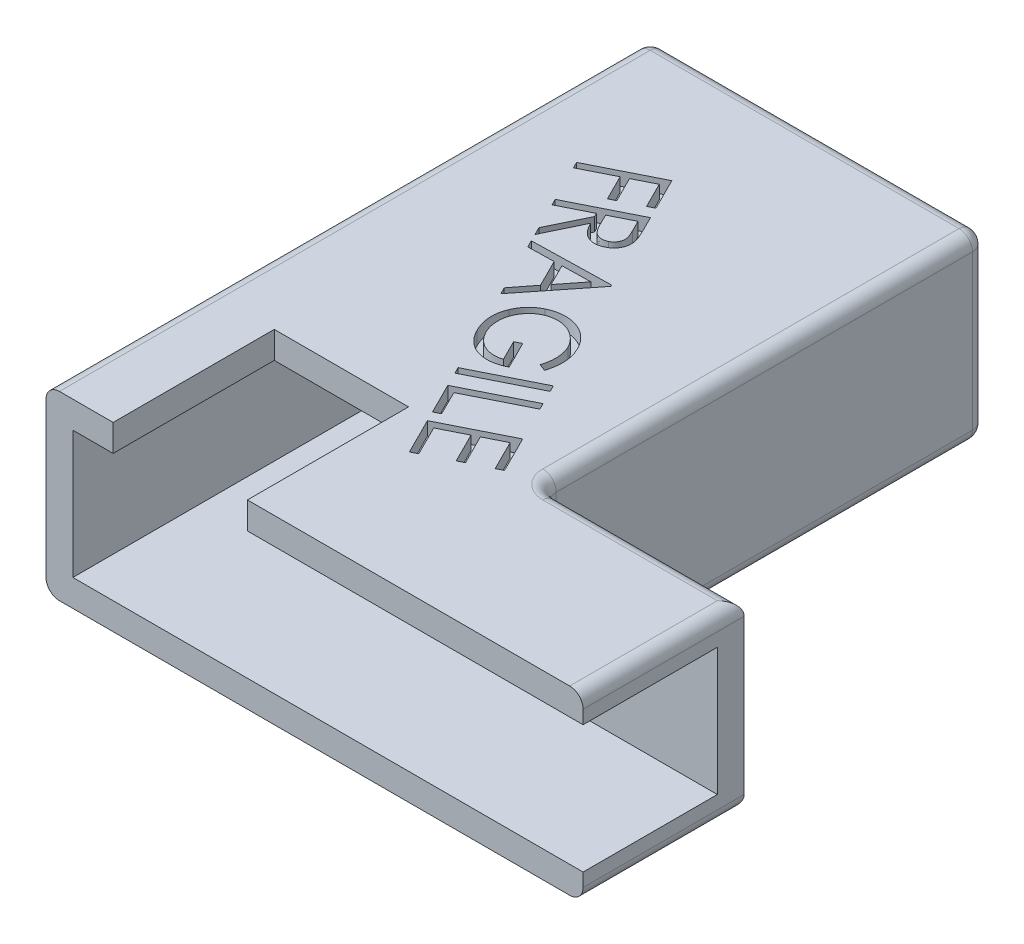
from build123d import *

# Parameters (mm, degrees)
BOSS_EXTRUDE1_DEPTH = 6.75
CUT_EXTRUDE3_DEPTH  = 4.75
CUT_EXTRUDE4_DEPTH  = 1
FILLET2_R           = 1
SKETCH7_W           = 10
SKETCH7_H           = 12
CUT_EXTRUDE6_DEPTH  = 2


with BuildPart() as part:
    # Sketch1 → Boss-Extrude1 (new body)
    with BuildSketch(Plane(origin=(0, 0, 0), x_dir=(1, 0, 0), z_dir=(0, 1, 0))):
        Polygon((0, 0), (0, 45), (25, 45), (25, 12), (40, 12), (40, 0), align=None)
    extrude(amount=BOSS_EXTRUDE1_DEPTH)

    # Sketch4 → Cut-Extrude3 (cut)
    with BuildSketch(Plane(origin=(0, 6.75, 0), x_dir=(1, 0, 0), z_dir=(0, 1, 0))):
        Polygon((2, 0), (2, 43), (23, 43), (23, 10), (40, 10), (40, 0), align=None)
    extrude(amount=-CUT_EXTRUDE3_DEPTH, mode=Mode.SUBTRACT)

    # Mirror2: part across plane


with BuildPart() as part_1:
    add(part.part)
    add(part.part.mirror(Plane(origin=(0, 6.75, 0), x_dir=(0, 0, 1), z_dir=(0, -1, 0))))

    # Sketch5 → Cut-Extrude4 (cut)
    # profile 1 of 7: a face of its own
    with BuildSketch(Plane(origin=(0, 13.5, 0), x_dir=(1, 0, 0), z_dir=(0, 1, 0))):
        Polygon((10.212206657, 36.397034335), (11.398379534, 34.028928699), (10.931966607, 33.795722235), (9.980060223, 35.695294885), (8.502379267, 34.955394378), (9.45428565, 33.055821728), (8.988932752, 32.822615264), (8.037026369, 34.722187914), (5.719802143, 33.561455742), (5.48553565, 34.029988729), align=None)
    # profile 2 of 7: a face of its own
    with BuildSketch(Plane(origin=(0, 13.5, 0), x_dir=(1, 0, 0), z_dir=(0, 1, 0))):
        with BuildLine():
            Line((11.802597194, 33.216253261), (12.274310268, 32.274947172))
            add(Edge.make_bspline(
                [(12.274310268, 32.274947172), (12.305489154, 32.211740664), (12.365122969, 32.090849714), (12.449438342, 31.916556946), (12.523301711, 31.757184775), (12.587769249, 31.612641939), (12.640281225, 31.482558136), (12.684312122, 31.367557019), (12.718958828, 31.267757989), (12.735398463, 31.205121887), (12.742843254, 31.176756734)],
                knots=[0, 0, 0, 0, 1.41450932, 2.705439416, 3.885743353, 4.939894687, 5.88148064, 6.700709836, 7.411608266, 8, 8, 8, 8], degree=3))
            add(Edge.make_bspline(
                [(12.742843254, 31.176756734), (12.751732081, 31.138025173), (12.769303581, 31.061460327), (12.78210829, 30.945611182), (12.78764944, 30.831604923), (12.78504351, 30.718772379), (12.770996925, 30.607391812), (12.747168437, 30.497692725), (12.715800519, 30.389293389), (12.673995923, 30.2835588), (12.625068863, 30.180685136), (12.56521302, 30.084060558), (12.496811122, 29.993485405), (12.420526239, 29.908365935), (12.33491297, 29.829803055), (12.241427583, 29.756168121), (12.138433145, 29.689258606), (12.06475798, 29.650783305), (12.027323423, 29.631233897)],
                knots=[0, 0, 0, 0, 1.030585874, 2.037270015, 3.019599379, 3.992076591, 4.962346036, 5.928228341, 6.903253401, 7.887592627, 8.876066943, 9.855953285, 10.831711236, 11.818738111, 12.818127647, 13.843641548, 14.904348217, 16, 16, 16, 16], degree=3))
            add(Edge.make_bspline(
                [(12.027323423, 29.631233897), (11.96371232, 29.601885041), (11.839690502, 29.54466392), (11.644960762, 29.490320812), (11.450815286, 29.464290674), (11.257828576, 29.467383363), (11.069005111, 29.499185461), (10.886842053, 29.560193267), (10.713802812, 29.65092947), (10.57739765, 29.74810112), (10.473174315, 29.841569185), (10.394056464, 29.922898575), (10.316237194, 30.014955417), (10.239058577, 30.117302488), (10.160856144, 30.228702985), (10.085643601, 30.352027334), (10.008533662, 30.484341339), (9.960547708, 30.577607541), (9.935885455, 30.625541456)],
                knots=[0, 0, 0, 0, 1.275491154, 2.486810117, 3.669320756, 4.835400704, 5.991815185, 7.146793527, 8.32226535, 9.541335358, 10.189151225, 10.872441073, 11.608160371, 12.3850279, 13.208790561, 14.088244423, 15.017458352, 16, 16, 16, 16], degree=3))
            Line((9.935885455, 30.625541456), (8.589648142, 27.826003862))
            Line((8.589648142, 27.826003862), (8.297080033, 28.410080051))
            Line((8.297080033, 28.410080051), (9.645437405, 31.207497586))
            Line((9.645437405, 31.207497586), (9.509753644, 31.477805078))
            Line((9.509753644, 31.477805078), (7.312312739, 30.377494581))
            Line((7.312312739, 30.377494581), (7.075926187, 30.849207655))
            Line((7.075926187, 30.849207655), (11.802597194, 33.216253261))
        make_face()
        with BuildLine():
            Line((11.575750907, 32.512393753), (9.969806395, 31.708891483))
            Line((9.969806395, 31.708891483), (10.370497501, 30.89266886))
            add(Edge.make_bspline(
                [(10.370497501, 30.89266886), (10.389646738, 30.854710369), (10.426822117, 30.781019635), (10.485279443, 30.67684209), (10.541166707, 30.581009266), (10.596360095, 30.494477686), (10.651336963, 30.417739557), (10.704344627, 30.34882681), (10.757057523, 30.289954798), (10.824155329, 30.223488425), (10.912893071, 30.155981521), (11.026225342, 30.092730161), (11.147785245, 30.049646714), (11.274289309, 30.025723143), (11.403748539, 30.019760355), (11.532418148, 30.035874822), (11.659778409, 30.067628306), (11.739833914, 30.104455476), (11.780336577, 30.12308753)],
                knots=[0, 0, 0, 0, 1.114428451, 2.163496172, 3.130994844, 4.022616522, 4.852843401, 5.605155819, 6.30056977, 6.922856548, 8.078968302, 9.210815528, 10.312466522, 11.444275841, 12.575326779, 13.694442081, 14.833543843, 16, 16, 16, 16], degree=3))
            add(Edge.make_bspline(
                [(11.780336577, 30.12308753), (11.818527766, 30.143842197), (11.893875502, 30.184789264), (11.993382793, 30.265902544), (12.078867704, 30.360318489), (12.150460422, 30.465955407), (12.207388066, 30.579657841), (12.24274531, 30.69925602), (12.262273961, 30.821285895), (12.259437556, 30.925579085), (12.248381629, 31.013680124), (12.231905973, 31.08719059), (12.209587597, 31.168306501), (12.179580662, 31.256320925), (12.142132957, 31.351521563), (12.09853445, 31.454321249), (12.0488834, 31.564856846), (12.011675543, 31.640109572), (11.992342453, 31.67921066)],
                knots=[0, 0, 0, 0, 1.162087497, 2.292692764, 3.418137779, 4.562520382, 5.700979498, 6.808619015, 7.889994426, 8.997350933, 9.588933592, 10.266395831, 11.012550037, 11.841485571, 12.75530961, 13.75187071, 14.831878838, 16, 16, 16, 16], degree=3))
            Line((11.992342453, 31.67921066), (11.575750907, 32.512393753))
        make_face(mode=Mode.SUBTRACT)
    # profile 3 of 7: a face of its own
    with BuildSketch(Plane(origin=(0, 13.5, 0), x_dir=(1, 0, 0), z_dir=(0, 1, 0))):
        Polygon((14.759051178, 27.306525382), (11.136930785, 22.734618665), (10.882523734, 23.242372738), (12.065516522, 24.763514899), (11.045768258, 26.800891368), (9.120754904, 26.760610251), (8.856807588, 27.287444853), (14.700749562, 27.422068585), align=None)
        Polygon((13.727642591, 26.861313042), (11.608643859, 26.817851838), (12.417446277, 25.201307033), align=None, mode=Mode.SUBTRACT)
    # profile 4 of 7: a face of its own
    with BuildSketch(Plane(origin=(0, 13.5, 0), x_dir=(1, 0, 0), z_dir=(0, 1, 0))):
        with BuildLine():
            Line((17.708830561, 19.425771704), (17.178815871, 19.618697051))
            add(Edge.make_bspline(
                [(17.178815871, 19.618697051), (17.207920262, 19.716095321), (17.265319744, 19.908183523), (17.317561161, 20.201005748), (17.342407251, 20.491274396), (17.33937834, 20.7774171), (17.309371681, 21.054354488), (17.258333981, 21.318507181), (17.1815624, 21.566835111), (17.110851687, 21.721748779), (17.075993021, 21.798117457)],
                knots=[0, 0, 0, 0, 1.090643464, 2.150959598, 3.186474562, 4.214576681, 5.217906055, 6.17316086, 7.099412641, 8, 8, 8, 8], degree=3))
            add(Edge.make_bspline(
                [(17.075993021, 21.798117457), (17.052252497, 21.843709824), (17.00482034, 21.934800666), (16.922516941, 22.064349154), (16.834810143, 22.189423517), (16.737593398, 22.307300785), (16.632874987, 22.419606308), (16.519902463, 22.525731442), (16.4002096, 22.626591739), (16.273597573, 22.720605688), (16.141639872, 22.805851937), (16.006629651, 22.882705861), (15.86898284, 22.949507769), (15.72848269, 23.006222913), (15.585109466, 23.051368679), (15.439746622, 23.087952345), (15.291566462, 23.113147604), (15.14178856, 23.12897528), (14.992035734, 23.135215546), (14.843950567, 23.132597845), (14.698878511, 23.118133512), (14.556411658, 23.096361918), (14.416879794, 23.064273211), (14.279898213, 23.02269713), (14.144991736, 22.972367287), (14.058157675, 22.930883769), (14.01462817, 22.910088277)],
                knots=[0, 0, 0, 0, 1.023602203, 2.045096457, 3.054881536, 4.065255296, 5.086240082, 6.112042517, 7.151234627, 8.202916022, 9.251412248, 10.279072739, 11.295972597, 12.297257131, 13.294599634, 14.288233837, 15.281169632, 16.286306795, 17.286774449, 18.265460265, 19.234171694, 20.188946326, 21.134961851, 22.083618823, 23.03932717, 24, 24, 24, 24], degree=3))
            add(Edge.make_bspline(
                [(14.01462817, 22.910088277), (13.970843386, 22.886988605), (13.883782288, 22.841057516), (13.759320376, 22.762179102), (13.641336142, 22.674665453), (13.528699962, 22.579792549), (13.423889979, 22.474897678), (13.323732625, 22.363363733), (13.229480827, 22.243974171), (13.142852824, 22.116538903), (13.063550613, 21.984158526), (12.994383524, 21.84658451), (12.935105547, 21.705560148), (12.88491605, 21.560800367), (12.844888354, 21.412340482), (12.813700313, 21.260545303), (12.793987504, 21.104971171), (12.783093873, 20.946743233), (12.783470796, 20.787054086), (12.792907585, 20.628122968), (12.811852227, 20.470493305), (12.841613384, 20.314307327), (12.882312316, 20.159422581), (12.932058576, 20.00528409), (12.99227367, 19.852664948), (13.03985829, 19.753403728), (13.063781816, 19.703499402)],
                knots=[0, 0, 0, 0, 0.958373364, 1.905617186, 2.849890808, 3.801351144, 4.754507599, 5.718798181, 6.703007822, 7.697486439, 8.700800039, 9.689186917, 10.676602268, 11.661168615, 12.653762319, 13.652140774, 14.6595524, 15.688188091, 16.721387899, 17.749591108, 18.76972591, 19.793639978, 20.825910435, 21.868874541, 22.928560625, 24, 24, 24, 24], degree=3))
            add(Edge.make_bspline(
                [(13.063781816, 19.703499402), (13.095057369, 19.64434194), (13.156440345, 19.528236521), (13.262021488, 19.36544723), (13.376602355, 19.216285046), (13.50132869, 19.080979913), (13.635386014, 18.958636558), (13.778254406, 18.849026221), (13.931341754, 18.754405421), (14.091359075, 18.672847224), (14.257681691, 18.607520218), (14.426055514, 18.55737238), (14.596067794, 18.523933227), (14.767237096, 18.508449876), (14.939753049, 18.508038625), (15.113272137, 18.525526555), (15.288094644, 18.558975323), (15.402502893, 18.594644687), (15.460508245, 18.612729169)],
                knots=[0, 0, 0, 0, 1.112233068, 2.182924723, 3.221773303, 4.236313444, 5.23858161, 6.236241304, 7.225841215, 8.226937701, 9.218680529, 10.192811497, 11.144573681, 12.094593375, 13.046391827, 14.00866825, 14.990388358, 16, 16, 16, 16], degree=3))
            Line((15.460508245, 18.612729169), (14.705767326, 20.120090948))
            Line((14.705767326, 20.120090948), (15.16157996, 20.347997265))
            Line((15.16157996, 20.347997265), (16.181328224, 18.310620796))
            add(Edge.make_bspline(
                [(16.181328224, 18.310620796), (16.091170253, 18.268449973), (15.914723389, 18.185918064), (15.644977889, 18.090769651), (15.379369501, 18.021959318), (15.118142962, 17.979830503), (14.860569314, 17.966046432), (14.607119355, 17.978236288), (14.357690779, 18.019145571), (14.113986259, 18.085967191), (13.878693851, 18.177609093), (13.656492186, 18.295337259), (13.446286283, 18.434830392), (13.251603383, 18.600664148), (13.067768234, 18.787860807), (12.899527702, 19.00026309), (12.743657017, 19.235377078), (12.653894999, 19.404806632), (12.607969183, 19.491493526)],
                knots=[0, 0, 0, 0, 1.124394106, 2.200535496, 3.227236646, 4.221905612, 5.185737163, 6.137396387, 7.084115907, 8.036453592, 8.988657298, 9.931841074, 10.873298585, 11.834072463, 12.816829376, 13.834050308, 14.891814057, 16, 16, 16, 16], degree=3))
            add(Edge.make_bspline(
                [(12.607969183, 19.491493526), (12.581727109, 19.545697262), (12.529746523, 19.653064615), (12.460544665, 19.81582366), (12.40310193, 19.978871843), (12.350819357, 20.139460182), (12.311603968, 20.300649576), (12.277457614, 20.460120869), (12.256067391, 20.619640223), (12.241570645, 20.77772967), (12.237840558, 20.93525511), (12.24154951, 21.092066954), (12.255805399, 21.248093239), (12.277866683, 21.40353104), (12.309617047, 21.558271289), (12.351496756, 21.711969535), (12.400667878, 21.86524133), (12.441253002, 21.965133757), (12.461685128, 22.01542348)],
                knots=[0, 0, 0, 0, 1.10581367, 2.190407767, 3.245347638, 4.279611866, 5.289928162, 6.290130256, 7.272901491, 8.243365102, 9.204018092, 10.164671082, 11.122207412, 12.079281966, 13.046399366, 14.020673147, 15.003530055, 16, 16, 16, 16], degree=3))
            add(Edge.make_bspline(
                [(12.461685128, 22.01542348), (12.495530131, 22.091440818), (12.562381798, 22.241592551), (12.687667518, 22.451649827), (12.824741434, 22.648825098), (12.979555285, 22.8302488), (13.150940309, 22.995524053), (13.337106664, 23.147299065), (13.540443943, 23.28220781), (13.685008896, 23.359621429), (13.75810106, 23.398761822)],
                knots=[0, 0, 0, 0, 1.029893183, 2.034275993, 3.023912036, 4.001864804, 4.983063865, 5.96944254, 6.973348412, 8, 8, 8, 8], degree=3))
            add(Edge.make_bspline(
                [(13.75810106, 23.398761822), (13.814285225, 23.425707306), (13.925455666, 23.479023777), (14.097512251, 23.544602652), (14.2716481, 23.599014081), (14.44844274, 23.641066189), (14.627138602, 23.672452459), (14.808206702, 23.690022518), (14.991619229, 23.696767688), (15.176452307, 23.690000556), (15.360576992, 23.672201149), (15.541908157, 23.642576438), (15.71935983, 23.60121021), (15.892522757, 23.548033113), (16.062032909, 23.483310325), (16.22689764, 23.405393852), (16.389022138, 23.31768117), (16.545316379, 23.216520527), (16.696598515, 23.10596723), (16.840405694, 22.984476471), (16.976052802, 22.852757225), (17.104432944, 22.711409529), (17.22596057, 22.560811206), (17.337754361, 22.398948995), (17.443590281, 22.228595279), (17.505726686, 22.108787677), (17.537105801, 22.048284391)],
                knots=[0, 0, 0, 0, 1.001409127, 1.981467476, 2.957103692, 3.932607596, 4.901073092, 5.871602272, 6.854947762, 7.849647827, 8.842789463, 9.827118954, 10.801315311, 11.769847447, 12.737262772, 13.715673409, 14.699478222, 15.698516039, 16.706317444, 17.71006013, 18.722430057, 19.74384414, 20.778286389, 21.830973086, 22.90463333, 24, 24, 24, 24], degree=3))
            add(Edge.make_bspline(
                [(17.537105801, 22.048284391), (17.583905885, 21.948036838), (17.676486297, 21.749726087), (17.780656769, 21.440373251), (17.851304174, 21.126271795), (17.886271079, 20.860863154), (17.895402142, 20.645949321), (17.896065066, 20.481072765), (17.886008692, 20.313031035), (17.867859071, 20.141496327), (17.841353937, 19.967118351), (17.806283873, 19.789143758), (17.761505393, 19.608295633), (17.726541862, 19.487143257), (17.708830561, 19.425771704)],
                knots=[0, 0, 0, 0, 1.475369076, 2.918590448, 4.34484701, 5.765880787, 6.483274427, 7.214052629, 7.964889576, 8.728175752, 9.51497962, 10.317559171, 11.147734369, 12, 12, 12, 12], degree=3))
        make_face()
    # profile 5 of 7: a face of its own
    with BuildSketch(Plane(origin=(0, 13.5, 0), x_dir=(1, 0, 0), z_dir=(0, 1, 0))):
        Polygon((19.037510597, 18.746426455), (19.273897149, 18.273653351), (14.547226142, 15.906607745), (14.31083959, 16.379380849), align=None)
    # profile 6 of 7: a face of its own
    with BuildSketch(Plane(origin=(0, 13.5, 0), x_dir=(1, 0, 0), z_dir=(0, 1, 0))):
        Polygon((19.799587007, 17.222273635), (20.037033588, 16.747380473), (15.766175215, 14.608241184), (16.675680423, 12.792410855), (16.21986779, 12.564504538), (15.072916, 14.855228029), align=None)
    # profile 7 of 7: a face of its own
    with BuildSketch(Plane(origin=(0, 13.5, 0), x_dir=(1, 0, 0), z_dir=(0, 1, 0))):
        Polygon((21.317637598, 14.185112424), (22.674475205, 11.476737357), (22.208062278, 11.243530894), (21.087611223, 13.480192886), (19.609930266, 12.740292379), (20.720841057, 10.522710915), (20.258668247, 10.290564481), (19.147757457, 12.508145944), (17.29376607, 11.579560207), (18.404676861, 9.361978743), (17.938263934, 9.12877228), (16.590966591, 11.818066818), align=None)
    extrude(amount=-CUT_EXTRUDE4_DEPTH, mode=Mode.SUBTRACT)

    # Fillet2
    fillet2_edges = [part_1.edges().sort_by_distance(p)[0] for p in [
        (0, 6.75, -45),
        (25, 6.75, -45),
        (25, 6.75, -12),
        (40, 13.5, -6),
        (32.5, 13.5, -12),
        (25, 13.5, -28.5),
        (12.5, 13.5, -45),
        (0, 13.5, -22.5),
        (0, 0, -22.5),
        (12.5, 0, -45),
        (25, 0, -28.5),
        (32.5, 0, -12),
        (40, 0, -6),
    ]]
    fillet(fillet2_edges, radius=FILLET2_R)

    # Sketch7 → Cut-Extrude6 (cut)
    with BuildSketch(Plane(origin=(0, 13.5, 0), x_dir=(1, 0, 0), z_dir=(0, 1, 0))):
        with Locations((10, 6)):
            Rectangle(SKETCH7_W, SKETCH7_H)
    extrude(amount=-CUT_EXTRUDE6_DEPTH, mode=Mode.SUBTRACT)


solid = part_1.part
